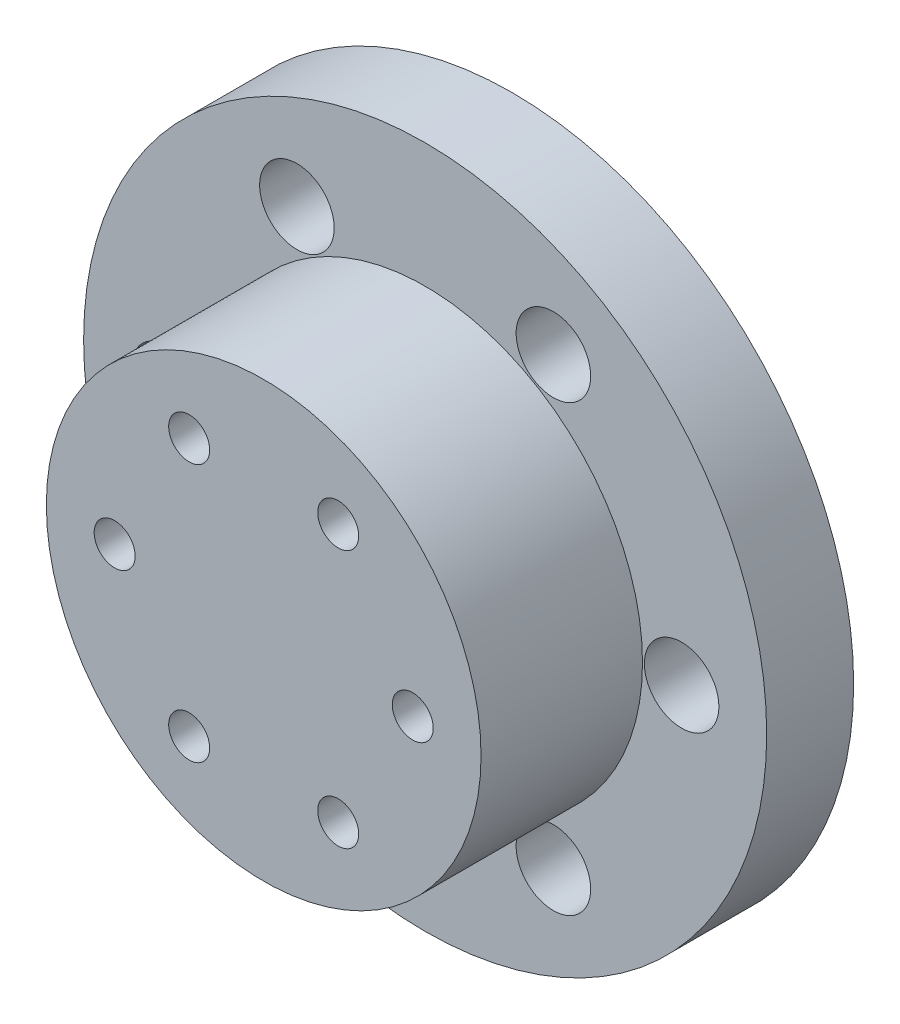
from build123d import *

# Parameters (mm, degrees)
SKETCH1_R             = 27.5
SKETCH1_R_2           = 3
BOSS_EXTRUDE1_DEPTH   = 7
SKETCH2_R             = 10.5
CUT_EXTRUDE1_DEPTH    = 5
SKETCH4_R             = 17.5
BOSS_EXTRUDE2_DEPTH   = 13
SKETCH6_R             = 9
CUT_EXTRUDE3_DEPTH    = 1.5
M4_TAPPED_HOLE1_D     = 3.3
M4_TAPPED_HOLE1_DEPTH = 8
M4_TAPPED_HOLE1_TIP   = 0.991420021


with BuildPart() as part:
    # Sketch1 → Boss-Extrude1 (new body)
    with BuildSketch(Plane.XY):
        Circle(SKETCH1_R)
        with Locations((20.65, 0)):
            Circle(SKETCH1_R_2, mode=Mode.SUBTRACT)
        with Locations((10.325, -17.883424588)):
            Circle(SKETCH1_R_2, mode=Mode.SUBTRACT)
        with Locations((-10.325, -17.883424588)):
            Circle(SKETCH1_R_2, mode=Mode.SUBTRACT)
        with Locations((-20.65, 0)):
            Circle(SKETCH1_R_2, mode=Mode.SUBTRACT)
        with Locations((-10.325, 17.883424588)):
            Circle(SKETCH1_R_2, mode=Mode.SUBTRACT)
        with Locations((10.325, 17.883424588)):
            Circle(SKETCH1_R_2, mode=Mode.SUBTRACT)
    extrude(amount=BOSS_EXTRUDE1_DEPTH)

    # Sketch2 → Cut-Extrude1 (cut)
    with BuildSketch(Plane(origin=(0, 0, 0), x_dir=(-1, 0, 0), z_dir=(0, 0, -1))):
        Circle(SKETCH2_R)
    extrude(amount=-CUT_EXTRUDE1_DEPTH, mode=Mode.SUBTRACT)

    # Sketch4 → Boss-Extrude2 (add)
    with BuildSketch(Plane.XY.offset(7)):
        Circle(SKETCH4_R)
    extrude(amount=BOSS_EXTRUDE2_DEPTH)

    # Sketch6 → Cut-Extrude3 (cut)
    with BuildSketch(Plane(origin=(0, 0, 5), x_dir=(-1, 0, 0), z_dir=(0, 0, -1))):
        Circle(SKETCH6_R)
    extrude(amount=-CUT_EXTRUDE3_DEPTH, mode=Mode.SUBTRACT)

    # M4 Tapped Hole1
    with Locations(Plane(origin=(-6, 10.392304845, 20), x_dir=(1, 0, 0), z_dir=(0, 0, 1))):
        with Locations((0, 0), (12, 0), (18, -10.392304845), (12, -20.78460969), (0, -20.78460969), (-6, -10.392304845)):
            Hole(M4_TAPPED_HOLE1_D / 2, depth=M4_TAPPED_HOLE1_DEPTH)
            with Locations((0, 0, -(M4_TAPPED_HOLE1_DEPTH + M4_TAPPED_HOLE1_TIP / 2))):  # 118° drill point
                Cone(0, M4_TAPPED_HOLE1_D / 2, M4_TAPPED_HOLE1_TIP, mode=Mode.SUBTRACT)


solid = part.part
